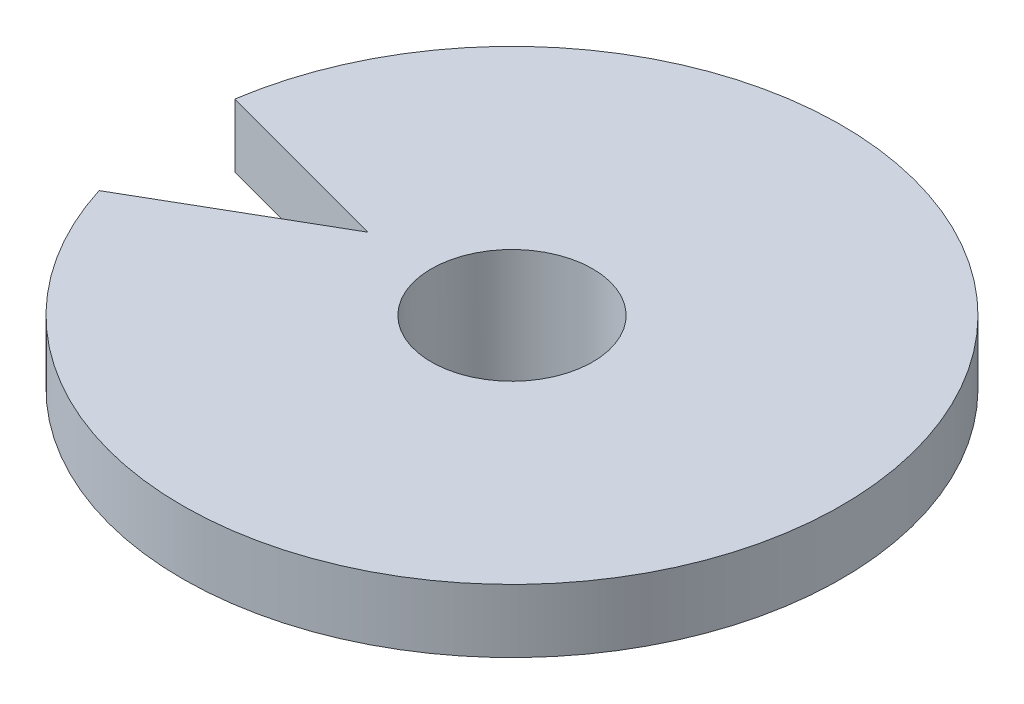
from build123d import *

# Parameters (mm, degrees)
SKETCH1_R               = 5.685
SKETCH1_R_2             = 3.185
BOSS_EXTRUDE1_DEPTH     = 4.46
SKETCH2_R               = 13
BOSS_EXTRUDE2_DEPTH     = 2.5
SKETCH3_R               = 3.185
CUT_EXTRUDE1_DEPTH      = 2.5
CUT_EXTRUDE3_DEPTH      = 19.918023153
CUT_EXTRUDE3_DEPTH_BACK = 19.918023153


with BuildPart() as part:
    # Sketch1 → Boss-Extrude1 (new body)
    with BuildSketch(Plane(origin=(0, 0, 0), x_dir=(1, 0, 0), z_dir=(0, 1, 0))):
        with Locations(Location((0, 0, 0), (0, 0, 270))):
            Circle(SKETCH1_R)
        with Locations(Location((0, 0, 0), (0, 0, 270))):
            Circle(SKETCH1_R_2, mode=Mode.SUBTRACT)
    extrude(amount=BOSS_EXTRUDE1_DEPTH)

    # Sketch2 → Boss-Extrude2 (add)
    with BuildSketch(Plane(origin=(0, 4.46, 0), x_dir=(1, 0, 0), z_dir=(0, 1, 0))):
        with Locations(Location((0, 0, 0), (0, 0, 270))):
            Circle(SKETCH2_R)
    extrude(amount=BOSS_EXTRUDE2_DEPTH)

    # Sketch3 → Cut-Extrude1 (cut)
    with BuildSketch(Plane.XZ.offset(-4.46)):
        with Locations(Location((0, 0, 0), (0, 0, 270))):
            Circle(SKETCH3_R)
    extrude(amount=-CUT_EXTRUDE1_DEPTH, mode=Mode.SUBTRACT)

    # Sketch4 → Cut-Extrude3 (cut, two sides: drawn at the far end of the back side and taken through both)
    with BuildSketch(Plane.XZ.offset(-4.46).offset(-CUT_EXTRUDE3_DEPTH_BACK)):
        Polygon((-81.445599846, -20.299991547), (-12.85716821, -1.92177668), (-5.685, 0), (-12.407156668, 3.881038962), (-73.901862147, 39.385023724), (-214.796857137, 57.193092978), (-222.340594836, -2.491922293), align=None)
    extrude(amount=CUT_EXTRUDE3_DEPTH + CUT_EXTRUDE3_DEPTH_BACK, mode=Mode.SUBTRACT)


solid = part.part
